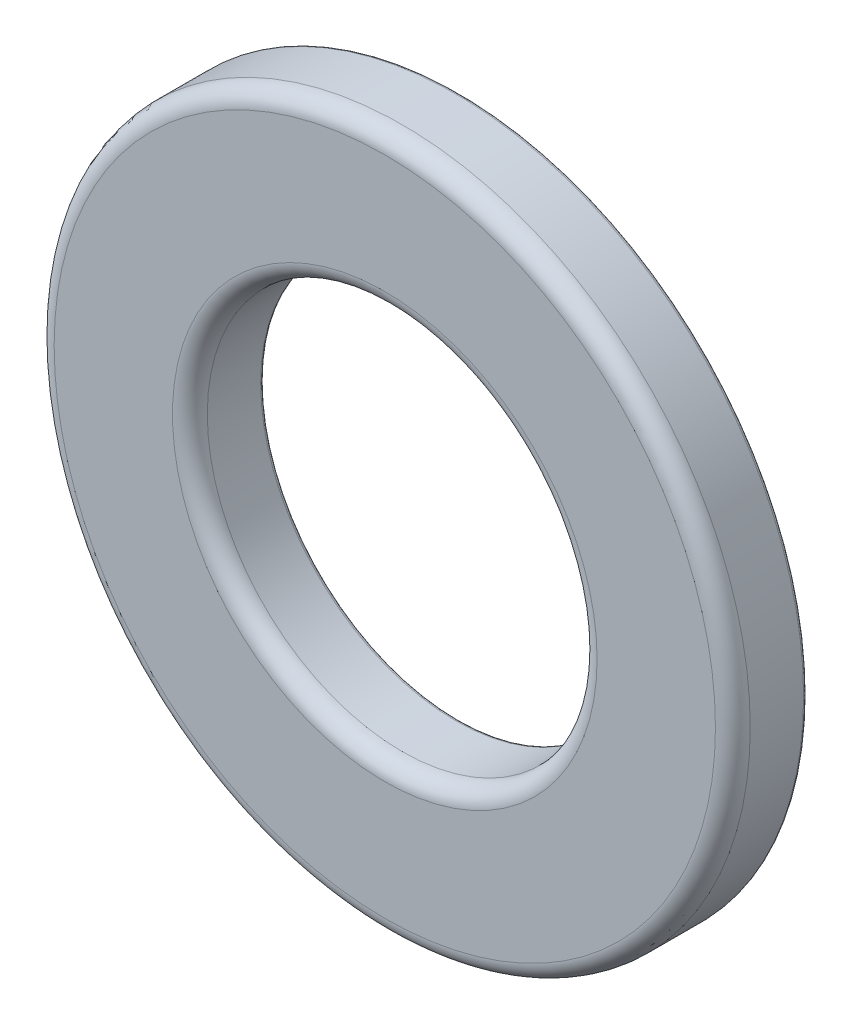
from build123d import *

# Parameters (mm, degrees)
BOSS_EXTRUDE1_DEPTH      = 0.8
BOSS_EXTRUDE1_DEPTH_BACK = 0.8
SKETCH3_R                = 7.5
SKETCH3_R_2              = 4.2
FILLET1_R                = 0.375
FILLET3_R                = 0.075


with BuildPart() as part:
    # Sketch3 → Boss-Extrude1 (new, two sides: drawn at the far end of the back side and taken through both)
    with BuildSketch(Plane.XY.offset(-BOSS_EXTRUDE1_DEPTH_BACK)):
        Circle(SKETCH3_R)
        Circle(SKETCH3_R_2, mode=Mode.SUBTRACT)
    extrude(amount=BOSS_EXTRUDE1_DEPTH + BOSS_EXTRUDE1_DEPTH_BACK)

    # Fillet1
    fillet1_edges = [part.edges().sort_by_distance(p)[0] for p in [
        (-7.5, 0, 0.8),
        (-4.2, 0, 0.8),
    ]]
    fillet(fillet1_edges, radius=FILLET1_R)

    # Fillet3
    fillet3_edges = [part.edges().sort_by_distance(p)[0] for p in [
        (-7.5, 0, -0.8),
        (-4.2, 0, -0.8),
    ]]
    fillet(fillet3_edges, radius=FILLET3_R)


solid = part.part
